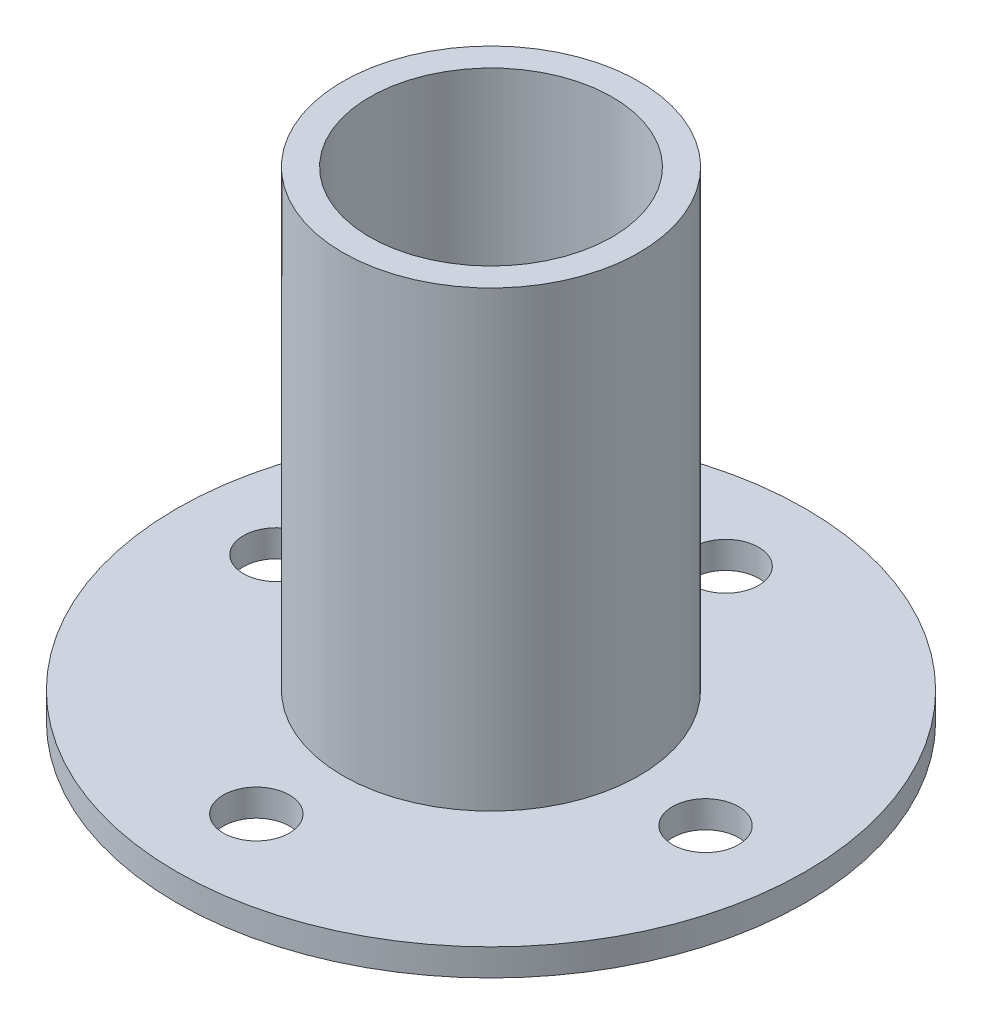
from build123d import *

# Parameters (mm, degrees)
SKETCH1_R           = 35
BOSS_EXTRUDE1_DEPTH = 3
SKETCH2_R           = 14
CUT_EXTRUDE1_DEPTH  = 6
SKETCH3_R           = 3.676124065
CUT_EXTRUDE2_DEPTH  = 6
CIRPATTERN1_COUNT   = 4
SKETCH4_R           = 16.5
SKETCH4_R_2         = 13.5
EXTRUDE_THIN1_DEPTH = 50.43


with BuildPart() as part:
    # Sketch1 → Boss-Extrude1 (new body)
    with BuildSketch(Plane(origin=(0, 0, 0), x_dir=(1, 0, 0), z_dir=(0, 1, 0))):
        with Locations(Location((0, 0, 0), (0, 0, 270))):
            Circle(SKETCH1_R)
    extrude(amount=BOSS_EXTRUDE1_DEPTH)

    # Sketch2 → Cut-Extrude1 (cut)
    with BuildSketch(Plane(origin=(0, 3, 0), x_dir=(1, 0, 0), z_dir=(0, 1, 0))):
        with Locations(Location((0, 0, 0), (0, 0, 270))):
            Circle(SKETCH2_R)
    extrude(amount=-CUT_EXTRUDE1_DEPTH, mode=Mode.SUBTRACT)

    # Sketch3 → Cut-Extrude2 (cut)
    with BuildSketch(Plane(origin=(0, 3, 0), x_dir=(1, 0, 0), z_dir=(0, 1, 0))):
        with Locations(Location((1.119457284, 25, 0), (0, 0, 270))):
            Circle(SKETCH3_R)
    cut_extrude2 = extrude(amount=-CUT_EXTRUDE2_DEPTH, mode=Mode.SUBTRACT)

    # CirPattern1: Cut-Extrude2 ×4 about axis
    cirpattern1_axis = Axis((0, 0, 0), (0, 1, 0))
    for i in range(1, CIRPATTERN1_COUNT):
        add(cut_extrude2.rotate(cirpattern1_axis, i * 360 / CIRPATTERN1_COUNT), mode=Mode.SUBTRACT)


with BuildPart() as body_2:
    # Sketch4 → Extrude-Thin1 (new body)
    with BuildSketch(Plane(origin=(0, 3, 0), x_dir=(1, 0, 0), z_dir=(0, 1, 0))):
        Circle(SKETCH4_R)
        Circle(SKETCH4_R_2, mode=Mode.SUBTRACT)
    extrude(amount=EXTRUDE_THIN1_DEPTH)


solid = Compound([part.part, body_2.part])
